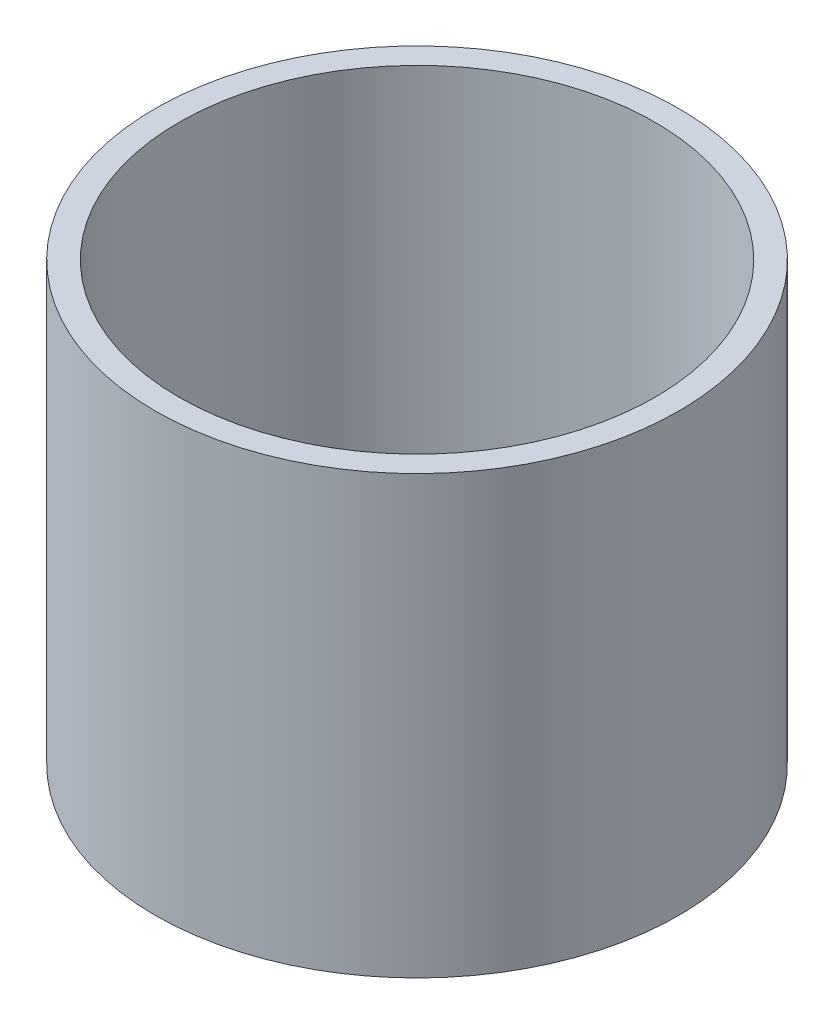
from build123d import *

# Parameters (mm, degrees)
SKETCH1_R           = 27.94
SKETCH1_R_2         = 25.4
BOSS_EXTRUDE1_DEPTH = 46.6


with BuildPart() as part:
    # Sketch1 → Boss-Extrude1 (new body)
    with BuildSketch(Plane(origin=(0, 0, 0), x_dir=(1, 0, 0), z_dir=(0, 1, 0))):
        with Locations(Location((0, 0, 0), (0, 0, 270))):
            Circle(SKETCH1_R)
        with Locations(Location((0, 0, 0), (0, 0, 270))):
            Circle(SKETCH1_R_2, mode=Mode.SUBTRACT)
    extrude(amount=BOSS_EXTRUDE1_DEPTH)


solid = part.part
